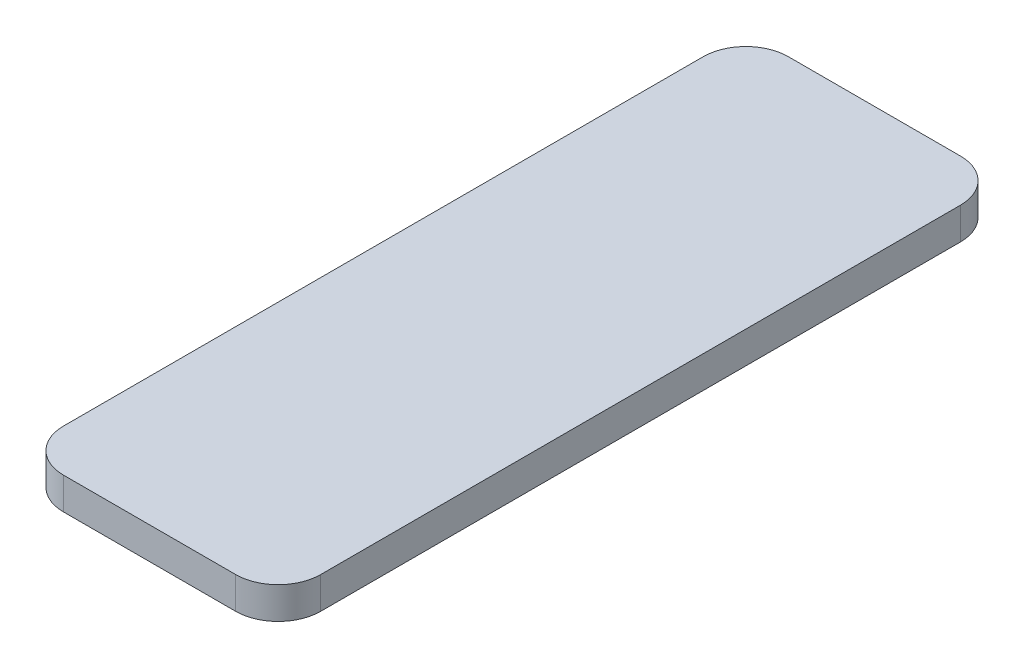
from build123d import *

# Parameters (mm, degrees)
SKETCH3_W             = 60.5
SKETCH3_H             = 7.5
BOSS_EXTRUDE1_DEPTH   = 85.25
SKETCH4_W             = 2
SKETCH4_H             = 140.5
BOSS_EXTRUDE2_DEPTH   = 2.5
BOSS_EXTRUDE2_2_DEPTH = 2.5
FILLET1_R             = 10


with BuildPart() as part:
    # Sketch3 → Boss-Extrude1 (new, symmetric)
    with BuildSketch(Plane.XY):
        Rectangle(SKETCH3_W, SKETCH3_H)
    extrude(amount=BOSS_EXTRUDE1_DEPTH, both=True)

    # Fillet1
    fillet1_edges = [part.edges().sort_by_distance(p)[0] for p in [
        (30.25, 0, 85.25),
        (-30.25, 0, 85.25),
        (30.25, 0, -85.25),
        (-30.25, 0, -85.25),
    ]]
    fillet(fillet1_edges, radius=FILLET1_R)


with BuildPart() as body_2:
    # Sketch4 → Boss-Extrude2 (new body)
    with BuildSketch(Plane.XZ.offset(3.75)):
        with Locations((-26.5, 0)):
            Rectangle(SKETCH4_W, SKETCH4_H)
    extrude(amount=BOSS_EXTRUDE2_DEPTH)


with BuildPart() as body_3:
    # Sketch4 → Boss-Extrude2 2 (new body)
    with BuildSketch(Plane.XZ.offset(3.75)):
        with Locations((26.5, 0)):
            Rectangle(SKETCH4_W, SKETCH4_H)
    extrude(amount=BOSS_EXTRUDE2_2_DEPTH)


solid = Compound([part.part, body_2.part, body_3.part])
